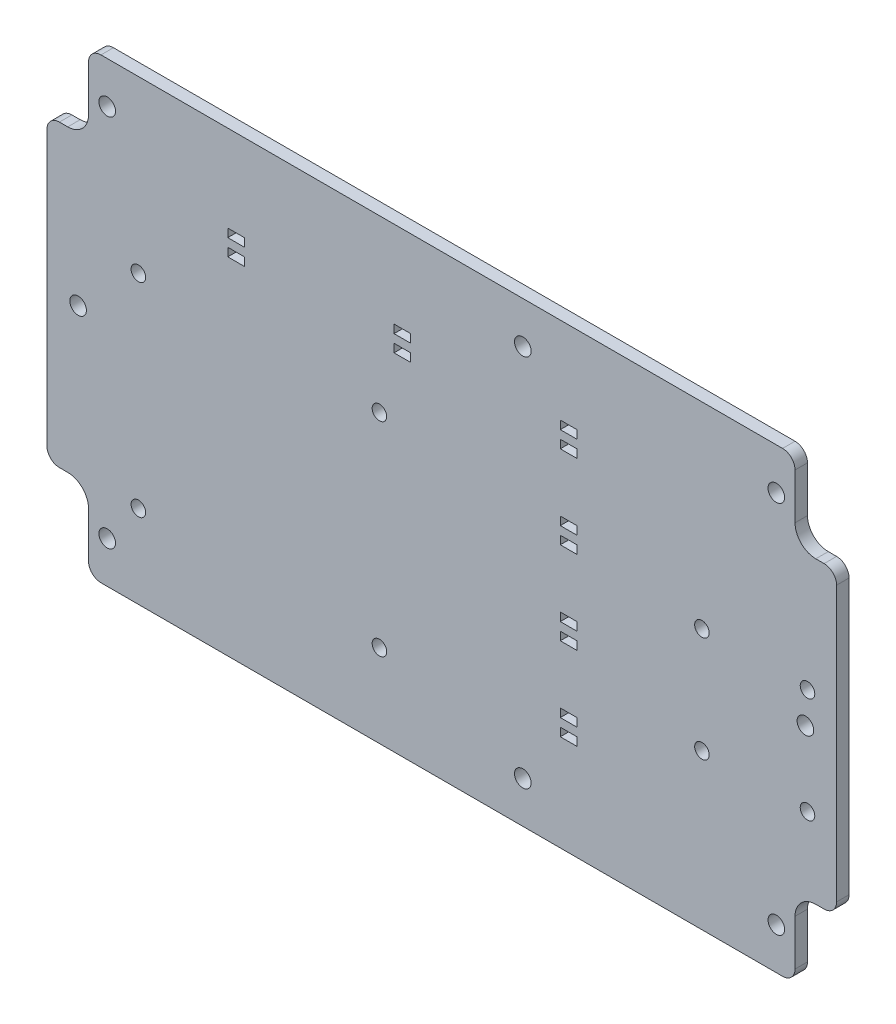
from build123d import *

# Parameters (mm, degrees)
SKETCH1_R                  = 2
BOSS_EXTRUDE1_DEPTH        = 3
F_3_5_3_5_DIAMETER_HOLE1_D = 3.5
SKETCH4_W                  = 4
SKETCH4_H                  = 2
CUT_EXTRUDE1_DEPTH         = 110.813478226


with BuildPart() as part:
    # Sketch1 → Boss-Extrude1 (new body)
    with BuildSketch(Plane.XY):
        with BuildLine():
            Line((-82, 55), (82, 55))
            ThreePointArc((82, 55), (84.121320344, 54.121320344), (85, 52))
            Line((85, 52), (85, 41))
            ThreePointArc((85, 41), (86.464466094, 37.464466094), (90, 36))
            Line((90, 36), (92, 36))
            ThreePointArc((92, 36), (94.121320344, 35.121320344), (95, 33))
            Line((95, 33), (95, -33))
            ThreePointArc((95, -33), (94.121320344, -35.121320344), (92, -36))
            Line((92, -36), (90, -36))
            ThreePointArc((90, -36), (86.464466094, -37.464466094), (85, -41))
            Line((85, -41), (85, -52))
            ThreePointArc((85, -52), (84.121320344, -54.121320344), (82, -55))
            Line((82, -55), (-82, -55))
            ThreePointArc((-82, -55), (-84.121320344, -54.121320344), (-85, -52))
            Line((-85, -52), (-85, -41))
            ThreePointArc((-85, -41), (-86.464466094, -37.464466094), (-90, -36))
            Line((-90, -36), (-92, -36))
            ThreePointArc((-92, -36), (-94.121320344, -35.121320344), (-95, -33))
            Line((-95, -33), (-95, 33))
            ThreePointArc((-95, 33), (-94.121320344, 35.121320344), (-92, 36))
            Line((-92, 36), (-90, 36))
            ThreePointArc((-90, 36), (-86.464466094, 37.464466094), (-85, 41))
            Line((-85, 41), (-85, 52))
            ThreePointArc((-85, 52), (-84.121320344, 54.121320344), (-82, 55))
        make_face()
        with Locations((-80.5, 45)):
            Circle(SKETCH1_R, mode=Mode.SUBTRACT)
        with Locations((19.5, 45)):
            Circle(SKETCH1_R, mode=Mode.SUBTRACT)
        with Locations((80.5, 45)):
            Circle(SKETCH1_R, mode=Mode.SUBTRACT)
        with Locations((-80.5, -45)):
            Circle(SKETCH1_R, mode=Mode.SUBTRACT)
        with Locations((-87.5, 0)):
            Circle(SKETCH1_R, mode=Mode.SUBTRACT)
        with Locations((87.5, 0)):
            Circle(SKETCH1_R, mode=Mode.SUBTRACT)
        with Locations((19.5, -45)):
            Circle(SKETCH1_R, mode=Mode.SUBTRACT)
        with Locations((80.5, -45)):
            Circle(SKETCH1_R, mode=Mode.SUBTRACT)
    extrude(amount=BOSS_EXTRUDE1_DEPTH)

    # Ø3.5 (3.5) Diameter Hole1 (through all)
    with Locations(Plane.XY.offset(3)):
        with Locations((88, 7.7), (88, -17.7), (62.6, -17.7), (62.6, 7.7), (-73, 14), (-15, 14), (-15, -35), (-73, -35)):
            Hole(F_3_5_3_5_DIAMETER_HOLE1_D / 2)

    # Sketch4 → Cut-Extrude1 (cut, through all)
    with BuildSketch(Plane.XY.offset(3)):
        with Locations((-9.482801071, 33.175325002)):
            Rectangle(SKETCH4_W, SKETCH4_H)
        with Locations((-49.482801071, 33.175325002)):
            Rectangle(SKETCH4_W, SKETCH4_H)
        with Locations((-49.482801071, 29.175325002)):
            Rectangle(SKETCH4_W, SKETCH4_H)
        with Locations((-9.482801071, 29.175325002)):
            Rectangle(SKETCH4_W, SKETCH4_H)
        with Locations((30.517198929, 33.175325002)):
            Rectangle(SKETCH4_W, SKETCH4_H)
        with Locations((30.517198929, 29.175325002)):
            Rectangle(SKETCH4_W, SKETCH4_H)
        with Locations((30.517198929, 13.175325002)):
            Rectangle(SKETCH4_W, SKETCH4_H)
        with Locations((30.517198929, 9.175325002)):
            Rectangle(SKETCH4_W, SKETCH4_H)
        with Locations((30.517198929, -6.824674998)):
            Rectangle(SKETCH4_W, SKETCH4_H)
        with Locations((30.517198929, -10.824674998)):
            Rectangle(SKETCH4_W, SKETCH4_H)
        with Locations((30.517198929, -26.824674998)):
            Rectangle(SKETCH4_W, SKETCH4_H)
        with Locations((30.517198929, -30.824674998)):
            Rectangle(SKETCH4_W, SKETCH4_H)
    extrude(amount=-CUT_EXTRUDE1_DEPTH, mode=Mode.SUBTRACT)


solid = part.part
